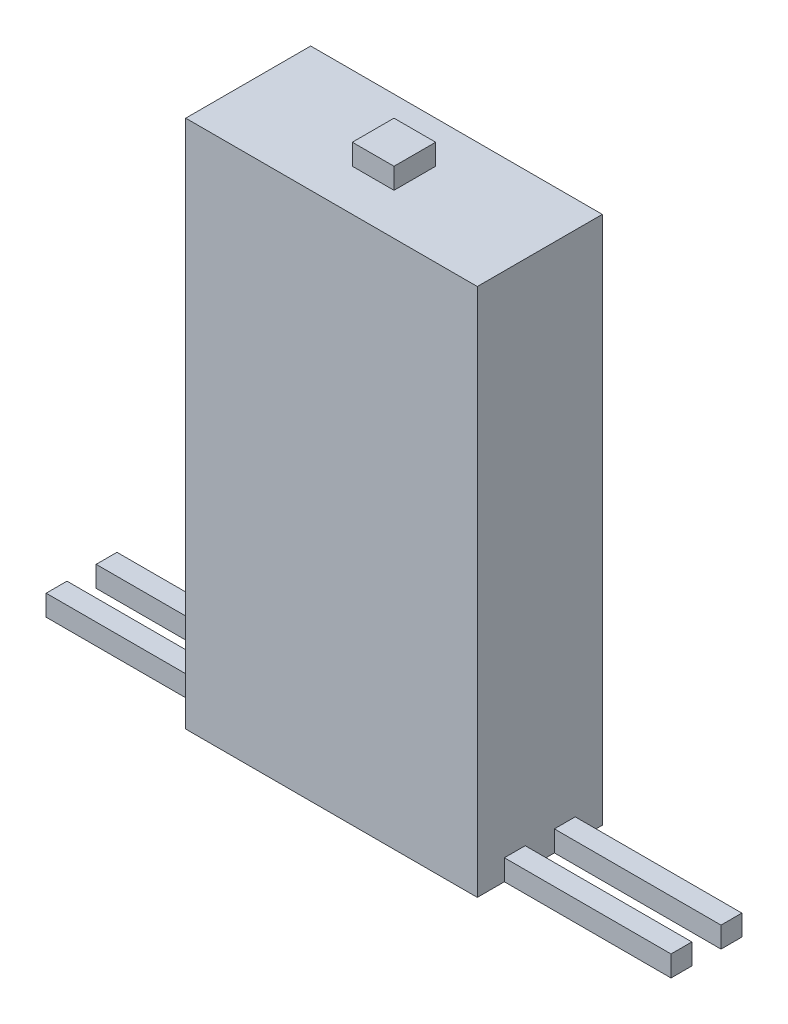
from build123d import *

# Parameters (mm, degrees)
SKETCH2_W           = 70
SKETCH2_H           = 30
BOSS_EXTRUDE1_DEPTH = 127
SKETCH3_W           = 5
SKETCH3_H           = 5
BOSS_EXTRUDE2_DEPTH = 40
SKETCH4_W           = 5
SKETCH4_H           = 5
BOSS_EXTRUDE3_DEPTH = 40
SKETCH5_W           = 10
SKETCH5_H           = 10
BOSS_EXTRUDE4_DEPTH = 5
SKETCH6_R           = 6
CUT_EXTRUDE1_DEPTH  = 4


with BuildPart() as part:
    # Sketch2 → Boss-Extrude1 (new body)
    with BuildSketch(Plane(origin=(0, 0, 0), x_dir=(1, 0, 0), z_dir=(0, 1, 0))):
        Rectangle(SKETCH2_W, SKETCH2_H)
    extrude(amount=BOSS_EXTRUDE1_DEPTH)

    # Sketch3 → Boss-Extrude2 (add)
    with BuildSketch(Plane(origin=(35, 0, 0), x_dir=(0, 0, -1), z_dir=(1, 0, 0))):
        with Locations((-6, 2.5)):
            Rectangle(SKETCH3_W, SKETCH3_H)
        with Locations((6, 2.5)):
            Rectangle(SKETCH3_W, SKETCH3_H)
    extrude(amount=BOSS_EXTRUDE2_DEPTH)

    # Sketch4 → Boss-Extrude3 (add)
    with BuildSketch(Plane.ZY.offset(35)):
        with Locations((-6, 2.5)):
            Rectangle(SKETCH4_W, SKETCH4_H)
        with Locations((6, 2.5)):
            Rectangle(SKETCH4_W, SKETCH4_H)
    extrude(amount=BOSS_EXTRUDE3_DEPTH)

    # Sketch5 → Boss-Extrude4 (add)
    with BuildSketch(Plane(origin=(0, 127, 0), x_dir=(1, 0, 0), z_dir=(0, 1, 0))):
        Rectangle(SKETCH5_W, SKETCH5_H)
    extrude(amount=BOSS_EXTRUDE4_DEPTH)

    # Sketch6 → Cut-Extrude1 (cut)
    with BuildSketch(Plane(origin=(0, 0, 0), x_dir=(-1, 0, 0), z_dir=(0, -1, 0))):
        with Locations(Location((0, 0, 0), (0, 0, 90))):
            Circle(SKETCH6_R)
    extrude(amount=-CUT_EXTRUDE1_DEPTH, mode=Mode.SUBTRACT)


solid = part.part
